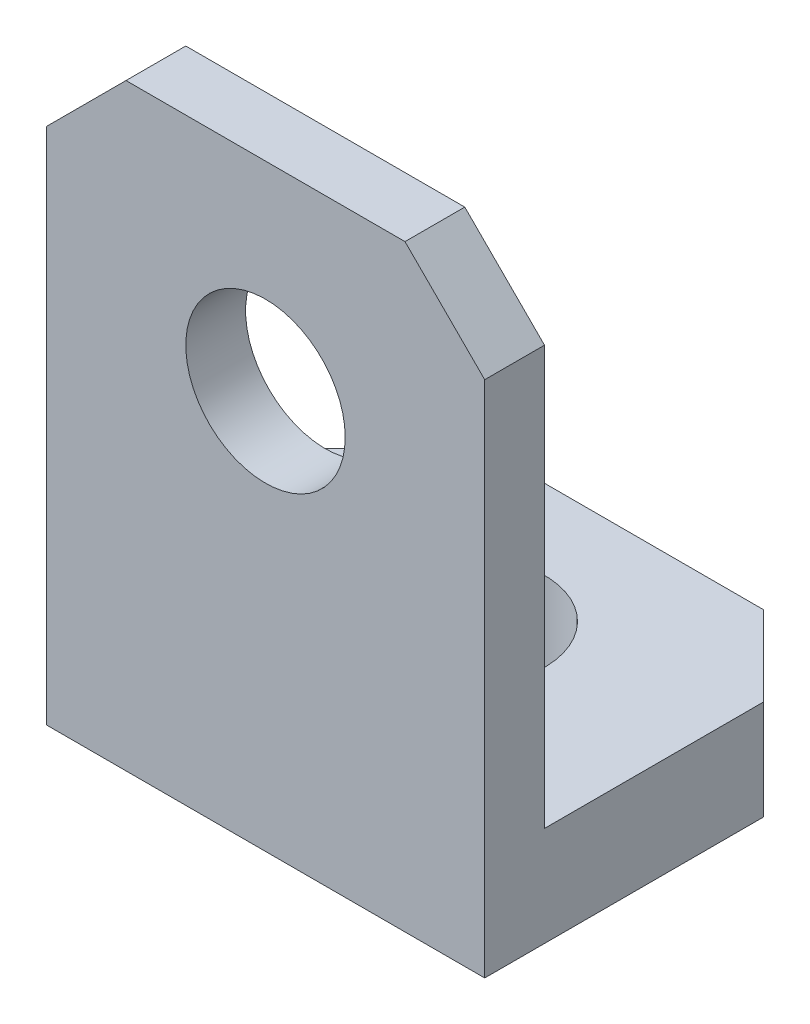
from build123d import *

# Parameters (mm, degrees)
SKETCH_1_W      = 22
SKETCH_1_H      = 18
SKETCH_1_R      = 4
EXTRUDE_1_DEPTH = 5
SKETCH_2_W      = 22
SKETCH_2_H      = 25
SKETCH_2_R      = 4
EXTRUDE_2_DEPTH = 3
CHAMFER_1_SIZE  = 4


with BuildPart() as part:
    # 草图1 → 凸台-拉伸1 (new body)
    with BuildSketch(Plane(origin=(0, 0, 0), x_dir=(1, 0, 0), z_dir=(0, 1, 0))):
        with Locations((-0.467181467, -2.976833977)):
            Rectangle(SKETCH_1_W, SKETCH_1_H)
        with Locations(Location((-0.467181467, -1.976833977, 0), (0, 0, 270))):
            Circle(SKETCH_1_R, mode=Mode.SUBTRACT)
    extrude(amount=EXTRUDE_1_DEPTH)

    # 草图2 → 凸台-拉伸2 (add)
    with BuildSketch(Plane.XY.offset(11.976833977)):
        with Locations((-0.467181467, 17.5)):
            Rectangle(SKETCH_2_W, SKETCH_2_H)
        with Locations((-0.467181467, 20)):
            Circle(SKETCH_2_R, mode=Mode.SUBTRACT)
    extrude(amount=-EXTRUDE_2_DEPTH)

    # 倒角1
    chamfer_1_edges = [part.edges().sort_by_distance(p)[0] for p in [
        (-11.467181467, 30, 10.476833977),
        (10.532818533, 30, 10.476833977),
        (-11.467181467, 2.5, -6.023166023),
        (10.532818533, 2.5, -6.023166023),
    ]]
    chamfer(chamfer_1_edges, length=CHAMFER_1_SIZE)


solid = part.part
